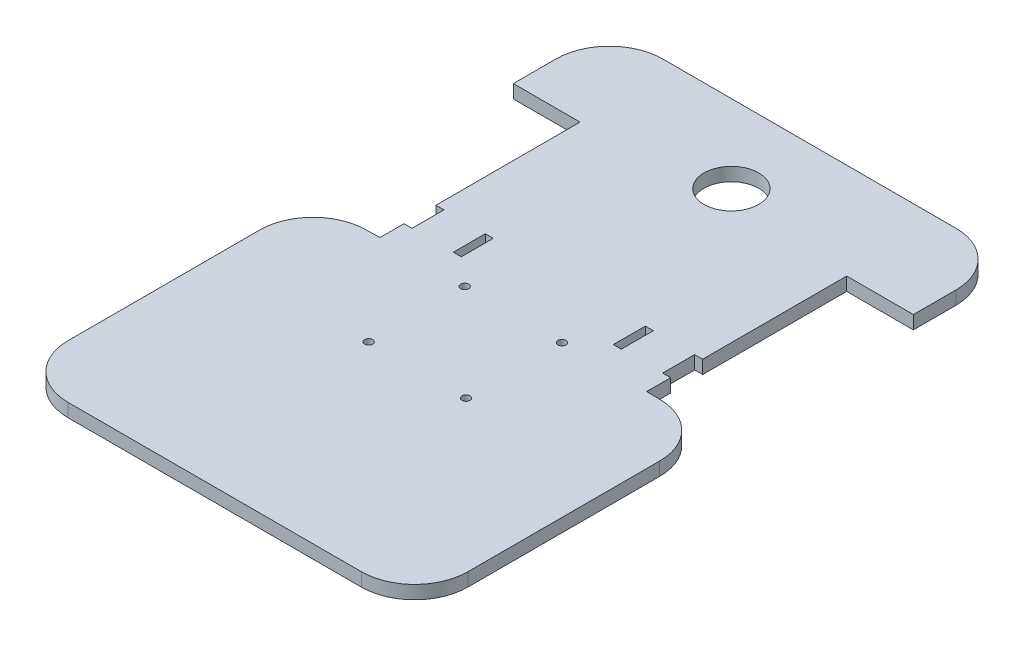
from build123d import *

# Parameters (mm, degrees)
SKETCH1_W           = 3
SKETCH1_H           = 12
BOSS_EXTRUDE1_DEPTH = 5
FILLET3_R           = 20
FILLET4_R           = 20
FILLET5_R           = 20


with BuildPart() as part:
    # Sketch1 → Boss-Extrude1 (new body)
    # profile 1 of 4: a face of its own
    with BuildSketch(Plane(origin=(0, 0, 0), x_dir=(1, 0, 0), z_dir=(0, 1, 0))):
        with BuildLine():
            Line((0, 0), (75, 0))
            Line((75, 0), (75, 76))
            Line((75, 76), (58.25, 76))
            ThreePointArc((58.25, 76), (55.689339828, 74.939339828), (56.75, 77.5))
            Line((56.75, 77.5), (56.75, 110.5))
            ThreePointArc((56.75, 110.5), (55.689339828, 113.060660172), (58.25, 112))
            Line((58.25, 112), (75, 112))
            Line((75, 112), (75, 183.494931242))
            ThreePointArc((75, 183.494931242), (64.75, 193.744931242), (75, 203.994931242))
            Line((75, 203.994931242), (75, 223))
            Line((75, 223), (25, 223))
            Line((25, 223), (0, 223))
            Line((0, 223), (0, 187))
            Line((0, 187), (25, 187))
            Line((25, 187), (25, 132.991356344))
            Line((25, 132.991356344), (28, 132.991356344))
            Line((28, 132.991356344), (28, 120.991356344))
            Line((28, 120.991356344), (25, 120.991356344))
            Line((25, 120.991356344), (25, 112))
            Line((25, 112), (0, 111.5))
            Line((0, 111.5), (0, 0))
        make_face()
        with Locations((45, 126.991356344)):
            Rectangle(SKETCH1_W, SKETCH1_H, mode=Mode.SUBTRACT)
    # profile 2 of 4: a face of its own
    with BuildSketch(Plane(origin=(0, 0, 0), x_dir=(1, 0, 0), z_dir=(0, 1, 0))):
        with BuildLine():
            Line((75, 76), (75, 0))
            Line((75, 0), (150, 0))
            Line((150, 0), (150, 111.5))
            Line((150, 111.5), (125, 112))
            Line((125, 112), (125, 120.991356344))
            Line((125, 120.991356344), (122, 120.991356344))
            Line((122, 120.991356344), (122, 132.991356344))
            Line((122, 132.991356344), (125, 132.991356344))
            Line((125, 132.991356344), (125, 187))
            Line((125, 187), (150, 187))
            Line((150, 187), (150, 223))
            Line((150, 223), (75, 223))
            Line((75, 223), (75, 203.994931242))
            ThreePointArc((75, 203.994931242), (82.247844507, 200.992775749), (85.25, 193.744931242))
            ThreePointArc((85.25, 193.744931242), (82.247844507, 186.497086735), (75, 183.494931242))
            Line((75, 183.494931242), (75, 112))
            Line((75, 112), (91.75, 112))
            ThreePointArc((91.75, 112), (93.25, 113.5), (94.75, 112))
            ThreePointArc((94.75, 112), (94.310660172, 110.939339828), (93.25, 110.5))
            Line((93.25, 110.5), (93.25, 77.5))
            ThreePointArc((93.25, 77.5), (94.310660172, 77.060660172), (94.75, 76))
            ThreePointArc((94.75, 76), (93.25, 74.5), (91.75, 76))
            Line((91.75, 76), (75, 76))
        make_face()
        with Locations((105, 126.991356344)):
            Rectangle(SKETCH1_W, SKETCH1_H, mode=Mode.SUBTRACT)
    # profile 3 of 4: a face of its own
    with BuildSketch(Plane(origin=(0, 0, 0), x_dir=(1, 0, 0), z_dir=(0, 1, 0))):
        with BuildLine():
            Line((75, 112), (75, 76))
            Line((75, 76), (91.75, 76))
            ThreePointArc((91.75, 76), (92.189339828, 77.060660172), (93.25, 77.5))
            Line((93.25, 77.5), (93.25, 110.5))
            ThreePointArc((93.25, 110.5), (92.189339828, 110.939339828), (91.75, 112))
            Line((91.75, 112), (75, 112))
        make_face()
    # profile 4 of 4: a face of its own
    with BuildSketch(Plane(origin=(0, 0, 0), x_dir=(1, 0, 0), z_dir=(0, 1, 0))):
        with BuildLine():
            Line((58.25, 76), (75, 76))
            Line((75, 76), (75, 112))
            Line((75, 112), (58.25, 112))
            ThreePointArc((58.25, 112), (57.810660172, 110.939339828), (56.75, 110.5))
            Line((56.75, 110.5), (56.75, 77.5))
            ThreePointArc((56.75, 77.5), (57.810660172, 77.060660172), (58.25, 76))
        make_face()
    extrude(amount=BOSS_EXTRUDE1_DEPTH)

    # Fillet3
    fillet3_edges = [part.edges().sort_by_distance(p)[0] for p in [
        (0, 2.5, -223),
    ]]
    fillet(fillet3_edges, radius=FILLET3_R)

    # Fillet4
    fillet4_edges = [part.edges().sort_by_distance(p)[0] for p in [
        (150, 2.5, -223),
    ]]
    fillet(fillet4_edges, radius=FILLET4_R)

    # Fillet5
    fillet5_edges = [part.edges().sort_by_distance(p)[0] for p in [
        (150, 2.5, -111.5),
        (150, 2.5, 0),
        (0, 2.5, 0),
        (0, 2.5, -111.5),
    ]]
    fillet(fillet5_edges, radius=FILLET5_R)


solid = part.part
